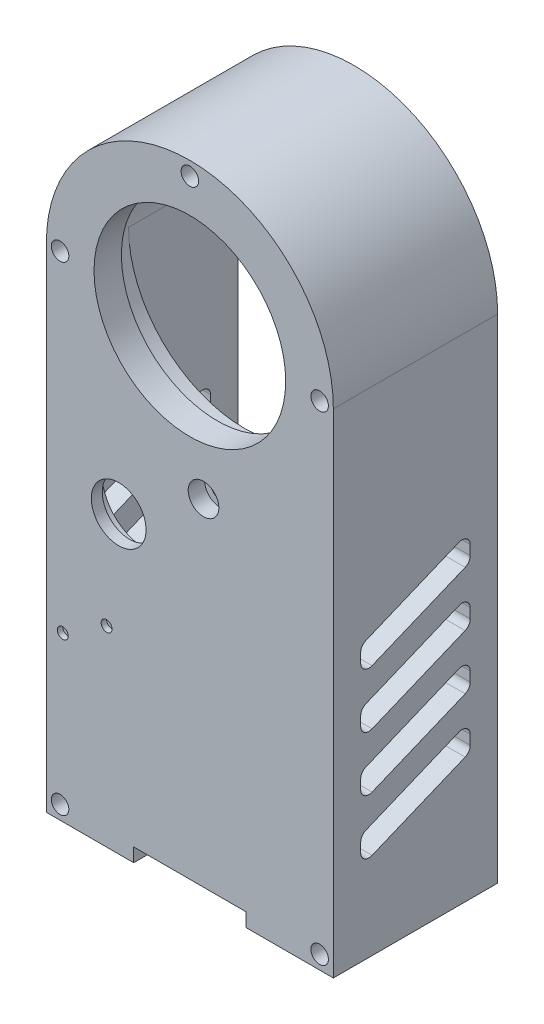
from build123d import *
from build123d.topology import SkipClean

# Parameters (mm, degrees)
SKETCH1_R           = 21.2
SKETCH1_R_2         = 17.5
BOSS_EXTRUDE1_DEPTH = 5
BOSS_EXTRUDE2_START = -5
SKETCH2_R           = 21.2
BOSS_EXTRUDE2_DEPTH = 5
BOSS_EXTRUDE3_START = 25
BOSS_EXTRUDE3_DEPTH = 25
SKETCH5_R           = 5
CUT_EXTRUDE1_DEPTH  = 98.012576504
SKETCH7_R           = 8.1
CUT_EXTRUDE2_DEPTH  = 3
SKETCH10_R          = 1.65
CUT_EXTRUDE3_DEPTH  = 23
SKETCH11_R          = 1.6
CUT_EXTRUDE4_DEPTH  = 33
SKETCH12_W          = 20.5
SKETCH12_H          = 5
CUT_EXTRUDE5_DEPTH  = 99.419713472
SKETCH13_R          = 1.6
CUT_EXTRUDE6_DEPTH  = 98.012576504
SKETCH14_R          = 2.8
CUT_EXTRUDE7_DEPTH  = 3
BOSS_EXTRUDE4_START = 5
BOSS_EXTRUDE4_DEPTH = 5
CUT_EXTRUDE9_DEPTH  = 108.101633974
SKETCH23_R          = 1
CUT_EXTRUDE11_DEPTH = 1


with BuildPart() as part:
    # Sketch1 → Boss-Extrude1 (new body)
    with BuildSketch(Plane.XY):
        Circle(SKETCH1_R)
        Circle(SKETCH1_R_2, mode=Mode.SUBTRACT)
    extrude(amount=BOSS_EXTRUDE1_DEPTH)

    # Sketch2 → Boss-Extrude2 (add)
    with BuildSketch(Plane.XY.offset(5).offset(BOSS_EXTRUDE2_START)):
        with BuildLine():
            Line((26.2, 0), (26.2, -90))
            Line((26.2, -90), (-26.2, -90))
            Line((-26.2, -90), (-26.2, 0))
            ThreePointArc((-26.2, 0), (0, 26.2), (26.2, 0))
        make_face()
        Circle(SKETCH2_R, mode=Mode.SUBTRACT)
    extrude(amount=BOSS_EXTRUDE2_DEPTH)

    # Sketch4 → Boss-Extrude3 (add)
    with BuildSketch(Plane(origin=(0, 0, 0), x_dir=(-1, 0, 0), z_dir=(0, 0, -1)).offset(BOSS_EXTRUDE3_START)):
        with BuildLine():
            Line((-26.2, 0), (-26.2, -90))
            Line((-26.2, -90), (26.2, -90))
            Line((26.2, -90), (26.2, 0))
            ThreePointArc((26.2, 0), (0, 26.2), (-26.2, 0))
        make_face()
        with BuildLine():
            Line((-21.2, 0), (-21.2, -85))
            Line((-21.2, -85), (21.2, -85))
            Line((21.2, -85), (21.2, 0))
            ThreePointArc((21.2, 0), (0, 21.2), (-21.2, 0))
        make_face(mode=Mode.SUBTRACT)
    extrude(amount=-BOSS_EXTRUDE3_DEPTH)

    # Sketch5 → Cut-Extrude1 (cut, through all)
    with BuildSketch(Plane(origin=(0, 0, 0), x_dir=(-1, 0, 0), z_dir=(0, 0, -1))):
        with Locations((12.995105527, -36.242762456)):
            Circle(SKETCH5_R)
    extrude(amount=-CUT_EXTRUDE1_DEPTH, mode=Mode.SUBTRACT)

    # Sketch7 → Cut-Extrude2 (cut)
    with BuildSketch(Plane(origin=(0, 0, 0), x_dir=(-1, 0, 0), z_dir=(0, 0, -1))):
        with Locations((12.995105527, -36.242762456)):
            Circle(SKETCH7_R)
    extrude(amount=-CUT_EXTRUDE2_DEPTH, mode=Mode.SUBTRACT)

    # Sketch10 → Cut-Extrude3 (cut)
    with BuildSketch(Plane.XZ.offset(90)):
        with Locations(Location((15.5, -5.5, 0), (0, 0, 270))):
            Circle(SKETCH10_R)
        with Locations((15.5, -36.5)):
            Circle(SKETCH10_R)
        with Locations((-15.5, -36.5)):
            Circle(SKETCH10_R)
        with Locations(Location((-15.5, -5.5, 0), (0, 0, 270))):
            Circle(SKETCH10_R)
    extrude(amount=-CUT_EXTRUDE3_DEPTH, mode=Mode.SUBTRACT)

    # Sketch11 → Cut-Extrude4 (cut)
    with BuildSketch(Plane(origin=(0, 0, -25), x_dir=(-1, 0, 0), z_dir=(0, 0, -1))):
        with Locations((-23.7, -87.5)):
            Circle(SKETCH11_R)
        with Locations((23.7, -87.5)):
            Circle(SKETCH11_R)
        with Locations((0, 23.7)):
            Circle(SKETCH11_R)
        with Locations((23.7, 0)):
            Circle(SKETCH11_R)
        with Locations((-23.7, 0)):
            Circle(SKETCH11_R)
    extrude(amount=-CUT_EXTRUDE4_DEPTH, mode=Mode.SUBTRACT)

    # Sketch12 → Cut-Extrude5 (cut, through all)
    with BuildSketch(Plane(origin=(0, 0, -25), x_dir=(-1, 0, 0), z_dir=(0, 0, -1))):
        with Locations((0, -90)):
            Rectangle(SKETCH12_W, SKETCH12_H)
    extrude(amount=-CUT_EXTRUDE5_DEPTH, mode=Mode.SUBTRACT)

    # Sketch13 → Cut-Extrude6 (cut, through all)
    with BuildSketch(Plane(origin=(0, 0, 0), x_dir=(-1, 0, 0), z_dir=(0, 0, -1))):
        with Locations((-2.493558329, -26.106401349)):
            Circle(SKETCH13_R)
    extrude(amount=-CUT_EXTRUDE6_DEPTH, mode=Mode.SUBTRACT)

    # Sketch14 → Cut-Extrude7 (cut)
    with BuildSketch(Plane.XY.offset(5)):
        with Locations((2.493558329, -26.106401349)):
            Circle(SKETCH14_R)
    extrude(amount=-CUT_EXTRUDE7_DEPTH, mode=Mode.SUBTRACT)

    # Sketch15 → Boss-Extrude4 (add)
    with SkipClean():  # the faces are left unmerged after this step: merging them gives an invalid solid
        with BuildSketch(Plane(origin=(0, 0, 0), x_dir=(-1, 0, 0), z_dir=(0, 0, -1)).offset(BOSS_EXTRUDE4_START)):
            with BuildLine():
                Line((21.2, -11.670475569), (21.2, 0))
                ThreePointArc((21.2, 0), (0, -21.2), (-21.2, 0))
                Line((-21.2, 0), (-21.2, -11.670475569))
                ThreePointArc((-21.2, -11.670475569), (0, -24.2), (21.2, -11.670475569))
            make_face()
        extrude(amount=-BOSS_EXTRUDE4_DEPTH)

    # Sketch19 → Cut-Extrude9 (cut, through all)
    with SkipClean():  # the faces are left unmerged after this step: merging them gives an invalid solid
        with BuildSketch(Plane(origin=(26.2, 0, 0), x_dir=(0, 0, -1), z_dir=(1, 0, 0))):
            with BuildLine():
                Line((0, -61.002267957), (0, -62.755091356))
                ThreePointArc((0, -62.755091356), (0.66664465, -64.002295774), (2.074025149, -64.140910655))
                Line((2.074025149, -64.140910655), (19.074025149, -57.099280094))
                ThreePointArc((19.074025149, -57.099280094), (19.747204418, -56.546816145), (20, -55.713460796))
                Line((20, -55.713460796), (20, -53.960637397))
                ThreePointArc((20, -53.960637397), (19.33335535, -52.713432978), (17.925974851, -52.574818098))
                Line((17.925974851, -52.574818098), (0.925974851, -59.616448658))
                ThreePointArc((0.925974851, -59.616448658), (0.252795582, -60.168912607), (0, -61.002267957))
            make_face()
            with BuildLine():
                Line((0, -71.002267957), (0, -72.755091356))
                ThreePointArc((0, -72.755091356), (0.66664465, -74.002295774), (2.074025149, -74.140910655))
                Line((2.074025149, -74.140910655), (19.074025149, -67.099280094))
                ThreePointArc((19.074025149, -67.099280094), (19.747204418, -66.546816145), (20, -65.713460796))
                Line((20, -65.713460796), (20, -63.960637397))
                ThreePointArc((20, -63.960637397), (19.33335535, -62.713432978), (17.925974851, -62.574818098))
                Line((17.925974851, -62.574818098), (0.925974851, -69.616448658))
                ThreePointArc((0.925974851, -69.616448658), (0.252795582, -70.168912607), (0, -71.002267957))
            make_face()
            with BuildLine():
                Line((0, -51.002267957), (0, -52.755091356))
                ThreePointArc((0, -52.755091356), (0.66664465, -54.002295774), (2.074025149, -54.140910655))
                Line((2.074025149, -54.140910655), (19.074025149, -47.099280094))
                ThreePointArc((19.074025149, -47.099280094), (19.747204418, -46.546816145), (20, -45.713460796))
                Line((20, -45.713460796), (20, -43.960637397))
                ThreePointArc((20, -43.960637397), (19.33335535, -42.713432978), (17.925974851, -42.574818098))
                Line((17.925974851, -42.574818098), (0.925974851, -49.616448658))
                ThreePointArc((0.925974851, -49.616448658), (0.252795582, -50.168912607), (0, -51.002267957))
            make_face()
            with BuildLine():
                Line((0, -41.002267957), (0, -42.755091356))
                ThreePointArc((0, -42.755091356), (0.66664465, -44.002295774), (2.074025149, -44.140910655))
                Line((2.074025149, -44.140910655), (19.074025149, -37.099280094))
                ThreePointArc((19.074025149, -37.099280094), (19.747204418, -36.546816145), (20, -35.713460796))
                Line((20, -35.713460796), (20, -33.960637397))
                ThreePointArc((20, -33.960637397), (19.33335535, -32.713432978), (17.925974851, -32.574818098))
                Line((17.925974851, -32.574818098), (0.925974851, -39.616448658))
                ThreePointArc((0.925974851, -39.616448658), (0.252795582, -40.168912607), (0, -41.002267957))
            make_face()
        extrude(amount=-CUT_EXTRUDE9_DEPTH, mode=Mode.SUBTRACT)

    # Sketch23 → Cut-Extrude11 (cut)
    with SkipClean():  # the faces are left unmerged after this step: merging them gives an invalid solid
        with BuildSketch(Plane.XY.offset(5)):
            with Locations((-15.2, -55.029144675)):
                Circle(SKETCH23_R)
            with Locations((-23.202663328, -60.148459048)):
                Circle(SKETCH23_R)
        extrude(amount=-CUT_EXTRUDE11_DEPTH, mode=Mode.SUBTRACT)


solid = part.part
